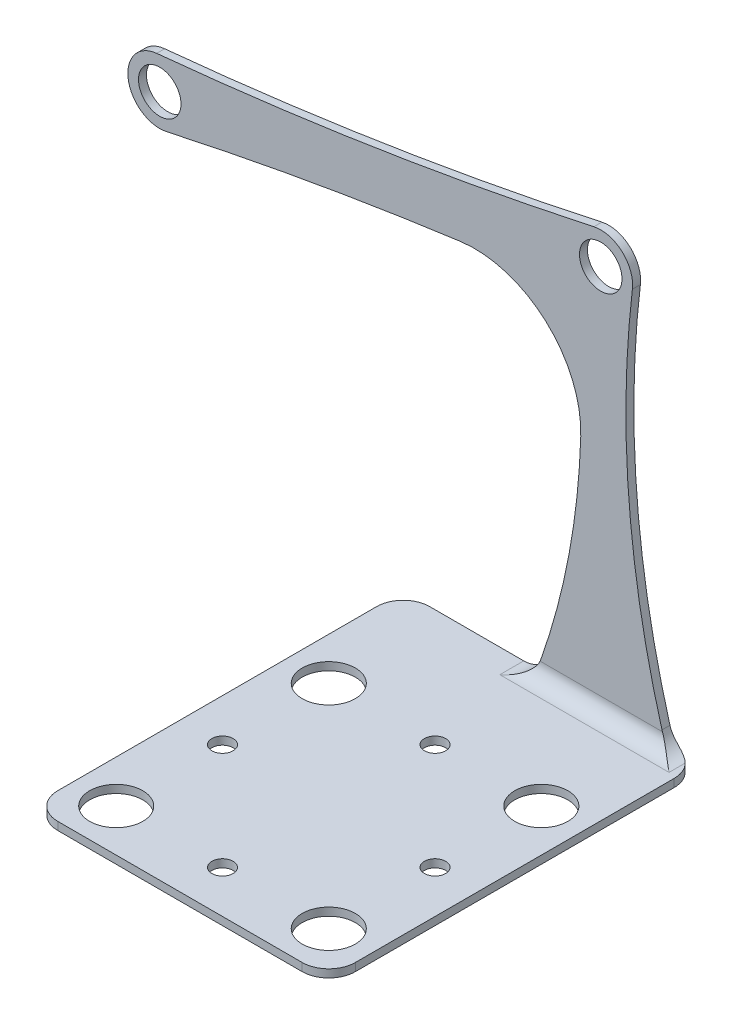
from build123d import *

# Parameters (mm, degrees)
SKETCH1_R           = 4
BOSS_EXTRUDE2_DEPTH = 1.5
SKETCH2_W           = 56
SKETCH2_H           = 70
SKETCH2_R           = 2
SKETCH2_R_2         = 5
BOSS_EXTRUDE3_DEPTH = 1.5
FILLET1_R           = 5
FILLET3_R           = 5
FILLET4_R           = 4.5
FILLET5_R           = 3


with BuildPart() as part:
    # Sketch1 → Boss-Extrude2 (new body)
    with BuildSketch(Plane.XY):
        with BuildLine():
            Line((70.488628725, -60.004327551), (95.488628725, -60.004327551))
            ThreePointArc((95.488628725, -60.004327551), (88.442611877, -24.198764926), (88.946986918, 12.290004224))
            ThreePointArc((88.946986918, 12.290004224), (87.020647932, 17.438961897), (81.709367557, 18.857710564))
            ThreePointArc((81.709367557, 18.857710564), (40.759501769, 11.190251314), (-0.573975371, 5.972482924))
            ThreePointArc((-0.573975371, 5.972482924), (-5.927759195, -0.928262318), (1.279261167, -5.862038115))
            ThreePointArc((1.279261167, -5.862038115), (28.82108484, -0.427804063), (56.558651128, 3.897744149))
            ThreePointArc((56.558651128, 3.897744149), (72.640680785, -1.071518566), (79.233271708, -16.559029494))
            ThreePointArc((79.233271708, -16.559029494), (76.676068341, -38.647024387), (70.488628725, -60.004327551))
        make_face()
        Circle(SKETCH1_R, mode=Mode.SUBTRACT)
        with Locations((82.988628725, 12.995672449)):
            Circle(SKETCH1_R, mode=Mode.SUBTRACT)
    extrude(amount=BOSS_EXTRUDE2_DEPTH)

    # Sketch2 → Boss-Extrude3 (add)
    with BuildSketch(Plane.XZ.offset(60.004327551)):
        with Locations((72.308628725, 35)):
            Rectangle(SKETCH2_W, SKETCH2_H)
        with Locations(Location((92.308628725, 42, 0), (0, 0, 270))):
            Circle(SKETCH2_R, mode=Mode.SUBTRACT)
        with Locations(Location((72.308628725, 22, 0), (0, 0, 270))):
            Circle(SKETCH2_R, mode=Mode.SUBTRACT)
        with Locations(Location((52.308628725, 42, 0), (0, 0, 270))):
            Circle(SKETCH2_R, mode=Mode.SUBTRACT)
        with Locations(Location((72.308628725, 62, 0), (0, 0, 270))):
            Circle(SKETCH2_R, mode=Mode.SUBTRACT)
        with Locations(Location((52.308628725, 22, 0), (0, 0, 270))):
            Circle(SKETCH2_R_2, mode=Mode.SUBTRACT)
        with Locations(Location((92.308628725, 22, 0), (0, 0, 270))):
            Circle(SKETCH2_R_2, mode=Mode.SUBTRACT)
        with Locations(Location((92.308628725, 62, 0), (0, 0, 270))):
            Circle(SKETCH2_R_2, mode=Mode.SUBTRACT)
        with Locations(Location((52.308628725, 62, 0), (0, 0, 270))):
            Circle(SKETCH2_R_2, mode=Mode.SUBTRACT)
    extrude(amount=BOSS_EXTRUDE3_DEPTH)

    # Fillet1
    fillet1_edges = [part.edges().sort_by_distance(p)[0] for p in [
        (100.308628725, -60.754327551, 0),
        (100.308628725, -60.754327551, 70),
        (44.308628725, -60.754327551, 70),
        (44.308628725, -60.754327551, 0),
    ]]
    fillet(fillet1_edges, radius=FILLET1_R)

    # Fillet3
    fillet3_edges = [part.edges().sort_by_distance(p)[0] for p in [
        (70.488628725, -60.004327551, 0.75),
    ]]
    fillet(fillet3_edges, radius=FILLET3_R)

    # Fillet4
    fillet4_edges = [part.edges().sort_by_distance(p)[0] for p in [
        (95.488628725, -60.004327551, 0.751620525),
    ]]
    fillet(fillet4_edges, radius=FILLET4_R)

    # Fillet5
    fillet5_edges = [part.edges().sort_by_distance(p)[0] for p in [
        (82.922685412, -60.004327551, 1.5),
    ]]
    fillet(fillet5_edges, radius=FILLET5_R)


solid = part.part
